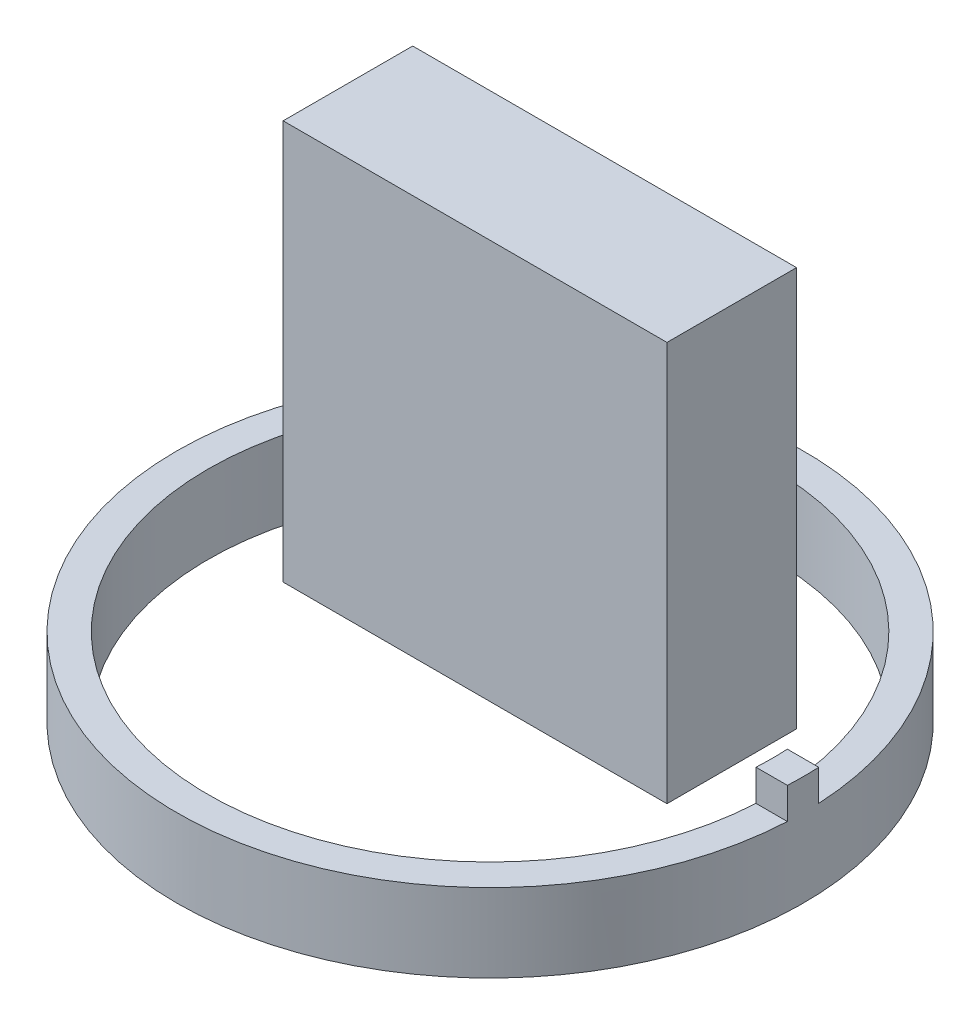
from build123d import *

# Parameters (mm, degrees)
SKETCH1_W           = 31.115
SKETCH1_H           = 10.5029
BOSS_EXTRUDE1_DEPTH = 32.385
SKETCH1_8_R         = 25.4
SKETCH1_8_R_2       = 22.86
BOSS_EXTRUDE4_DEPTH = 6.35
BOSS_EXTRUDE5_START = 6.35
BOSS_EXTRUDE5_DEPTH = 2.54


with BuildPart() as part:
    # Sketch1 → Boss-Extrude1 (new body)
    with BuildSketch(Plane(origin=(0, 0, 0), x_dir=(1, 0, 0), z_dir=(0, 1, 0))):
        with Locations((-2.667913404, 6.70111363)):
            Rectangle(SKETCH1_W, SKETCH1_H)
    extrude(amount=BOSS_EXTRUDE1_DEPTH)


with BuildPart() as body_2:
    # Sketch1<8> → Boss-Extrude4 (new body)
    with BuildSketch(Plane(origin=(0, 0, 0), x_dir=(1, 0, 0), z_dir=(0, 1, 0))):
        with Locations(Location((0, 0, 0), (0, 0, 270))):
            Circle(SKETCH1_8_R)
        with Locations(Location((0, 0, 0), (0, 0, 270))):
            Circle(SKETCH1_8_R_2, mode=Mode.SUBTRACT)
    extrude(amount=BOSS_EXTRUDE4_DEPTH)

    # Sketch1<9> → Boss-Extrude5 (add)
    with BuildSketch(Plane(origin=(0, 0, 0), x_dir=(1, 0, 0), z_dir=(0, 1, 0)).offset(BOSS_EXTRUDE5_START)):
        with BuildLine():
            Line((25.368230131, 1.27), (22.82469496, 1.27))
            ThreePointArc((22.82469496, 1.27), (22.851172035, 0.635245316), (22.86, 0))
            ThreePointArc((22.86, 0), (22.851172035, -0.635245316), (22.82469496, -1.27))
            Line((22.82469496, -1.27), (25.368230131, -1.27))
            ThreePointArc((25.368230131, -1.27), (25.392056291, -0.635198655), (25.4, 0))
            ThreePointArc((25.4, 0), (25.392056291, 0.635198655), (25.368230131, 1.27))
        make_face()
    extrude(amount=BOSS_EXTRUDE5_DEPTH)


solid = Compound([part.part, body_2.part])
